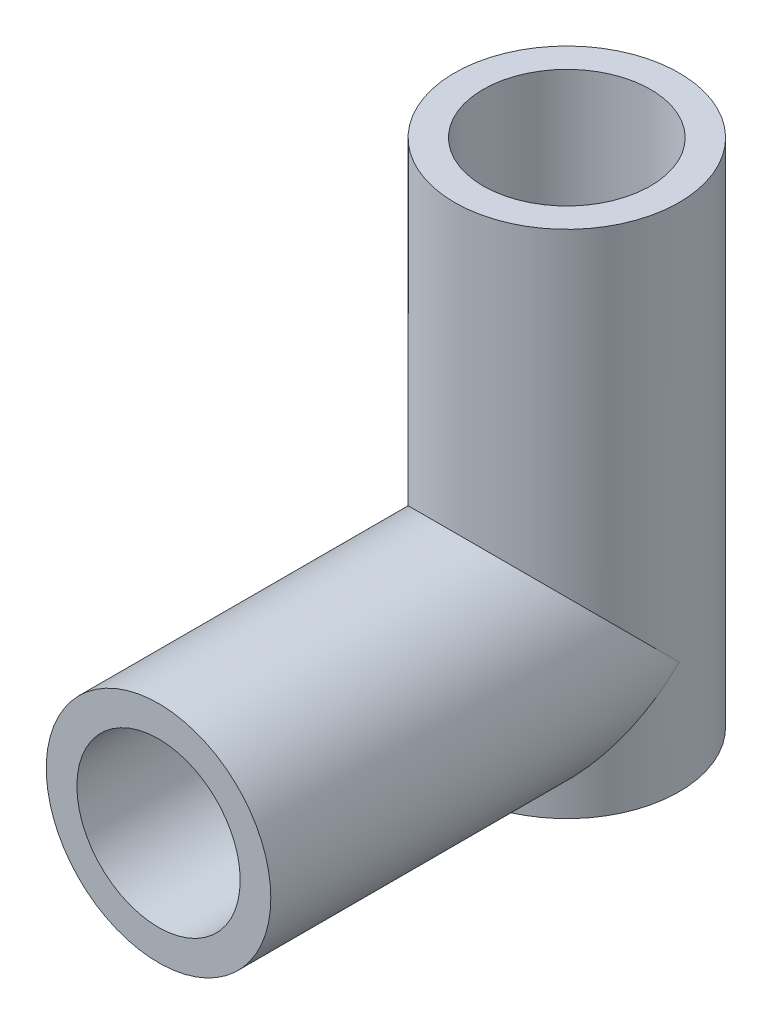
from build123d import *

# Parameters (mm, degrees)
SKETCH_1_R          = 5.5
SKETCH_1_R_2        = 4.1
EXTRUDE_1_DEPTH     = 25
SKETCH_2_R          = 5.5
SKETCH_2_R_2        = 4
EXTRUDE_2_DEPTH     = 20
SKETCH_4_R          = 4.1
CUT_EXTRUDE_1_DEPTH = 20
CUT_EXTRUDE_START   = -20
SKETCH_5_R          = 4
CUT_EXTRUDE_2_DEPTH = 20


with BuildPart() as part:
    # 草图1 → 凸台-拉伸1 (new body)
    with BuildSketch(Plane(origin=(0, 0, 0), x_dir=(1, 0, 0), z_dir=(0, 1, 0))):
        with Locations(Location((0, 0, 0), (0, 0, 270))):
            Circle(SKETCH_1_R)
        with Locations(Location((0, 0, 0), (0, 0, 270))):
            Circle(SKETCH_1_R_2, mode=Mode.SUBTRACT)
    extrude(amount=EXTRUDE_1_DEPTH)

    # 草图2 → 凸台-拉伸2 (add)
    with BuildSketch(Plane.XY):
        with Locations((0, 5.5)):
            Circle(SKETCH_2_R)
        with Locations(Location((0, 5.5, 0), (0, 0, 180))):
            Circle(SKETCH_2_R_2, mode=Mode.SUBTRACT)
    extrude(amount=EXTRUDE_2_DEPTH)

    # 草图4 → 切除-拉伸1 (cut)
    with BuildSketch(Plane(origin=(0, 0, 0), x_dir=(1, 0, 0), z_dir=(0, 1, 0))):
        with Locations(Location((0, 0, 0), (0, 0, 270))):
            Circle(SKETCH_4_R)
    extrude(amount=CUT_EXTRUDE_1_DEPTH, mode=Mode.SUBTRACT)

    # 草图5 → 切除-拉伸2 (cut)
    with BuildSketch(Plane.XY.offset(20).offset(CUT_EXTRUDE_START)):
        with Locations((0, 5.5)):
            Circle(SKETCH_5_R)
    extrude(amount=CUT_EXTRUDE_2_DEPTH, mode=Mode.SUBTRACT)


solid = part.part
